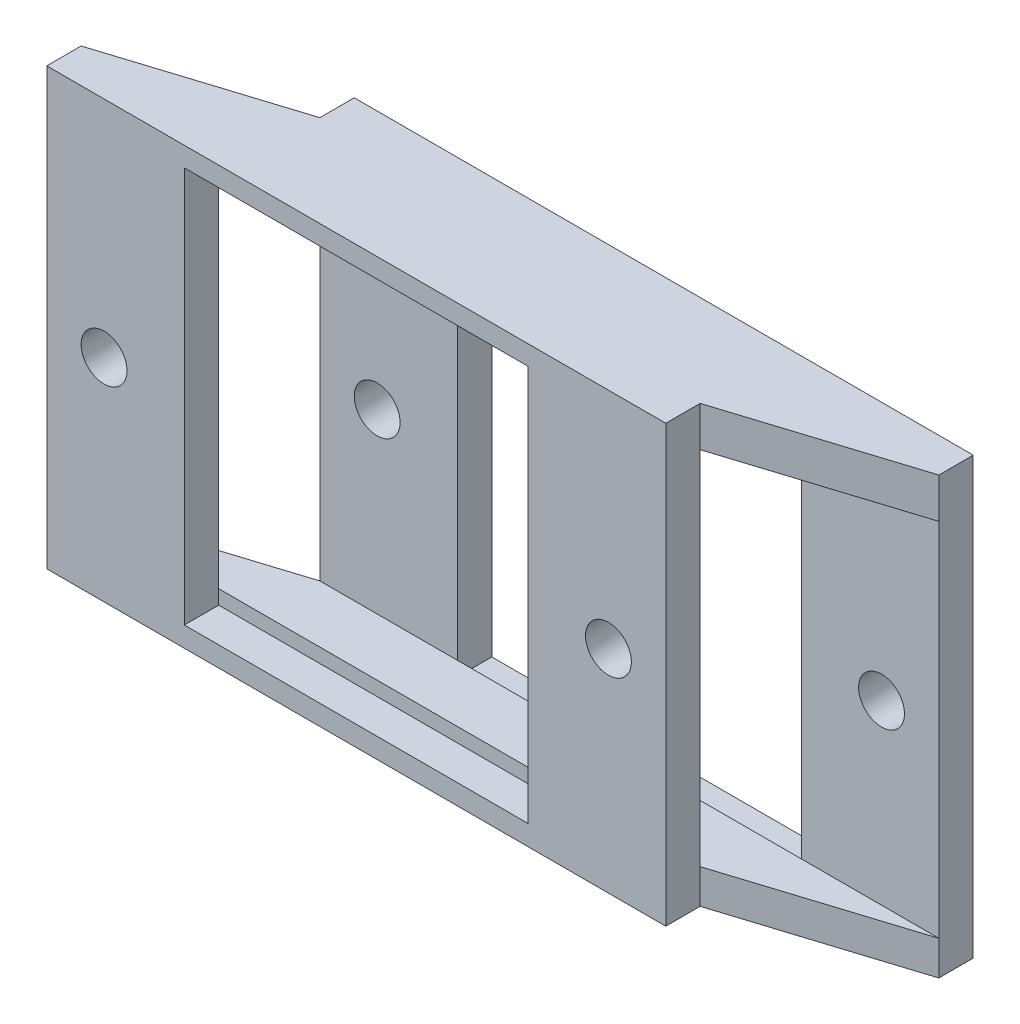
from build123d import *

# Parameters (mm, degrees)
SKETCH_1_W          = 54
SKETCH_1_H          = 38
EXTRUDE_1_DEPTH     = 3
SKETCH_3_R          = 2
SKETCH_3_W          = 30
SKETCH_3_H          = 34.54
CUT_EXTRUDE_1_DEPTH = 34.54
SKETCH_4_W          = 54
SKETCH_4_H          = 38
SKETCH_4_R          = 2
SKETCH_4_W_2        = 30
SKETCH_4_H_2        = 34.54
EXTRUDE_2_DEPTH     = 3
EXTRUDE_3_DEPTH     = 3.5
EXTRUDE_4_DEPTH     = 3


with BuildPart() as part:
    # 草图1 → 凸台-拉伸1 (new body)
    with BuildSketch(Plane.XY):
        with Locations((-8.445035234, 9.066128075)):
            Rectangle(SKETCH_1_W, SKETCH_1_H)
    extrude(amount=EXTRUDE_1_DEPTH)

    # 草图3 → 切除-拉伸1 (cut)
    with BuildSketch(Plane(origin=(0, 0, 0), x_dir=(-1, 0, 0), z_dir=(0, 0, -1))):
        with Locations((-13.554964766, 8.526128075)):
            Circle(SKETCH_3_R)
        with Locations((30.445035234, 8.526128075)):
            Circle(SKETCH_3_R)
        with Locations((8.445035234, 9.092740444)):
            Rectangle(SKETCH_3_W, SKETCH_3_H)
    extrude(amount=-CUT_EXTRUDE_1_DEPTH, mode=Mode.SUBTRACT)



with BuildPart() as body_2:
    # 草图4 → 凸台-拉伸2 (new body)
    with BuildSketch(Plane(origin=(15.82462623, 0, -5), x_dir=(-1, 0, 0), z_dir=(0, 0, -1))):
        with Locations((8.445035234, 9.066128075)):
            Rectangle(SKETCH_4_W, SKETCH_4_H)
        with Locations((-13.554964766, 8.526128075)):
            Circle(SKETCH_4_R, mode=Mode.SUBTRACT)
        with Locations((30.445035234, 8.526128075)):
            Circle(SKETCH_4_R, mode=Mode.SUBTRACT)
        with Locations((8.445035234, 9.092740444)):
            Rectangle(SKETCH_4_W_2, SKETCH_4_H_2, mode=Mode.SUBTRACT)
    extrude(amount=EXTRUDE_2_DEPTH)


with BuildPart() as part_1:
    add(part.part)

    add(body_2.part)  # 凸台-拉伸3 merges body 2
    # 草图5 → 凸台-拉伸3 (add)
    with BuildSketch(Plane(origin=(0, 28.066128075, 0), x_dir=(1, 0, 0), z_dir=(0, 1, 0))):
        Polygon((-19.620409004, 5), (-35.445035234, 0), (18.554964766, 0), (34.379590996, 5), align=None)
    extrude(amount=-EXTRUDE_3_DEPTH)

    # 草图6 → 凸台-拉伸4 (add)
    with BuildSketch(Plane.XZ.offset(9.933871925)):
        Polygon((-35.445035234, 0), (-19.620409004, -5), (34.379590996, -5), (18.554964766, 0), align=None)
    extrude(amount=-EXTRUDE_4_DEPTH)


solid = part_1.part
